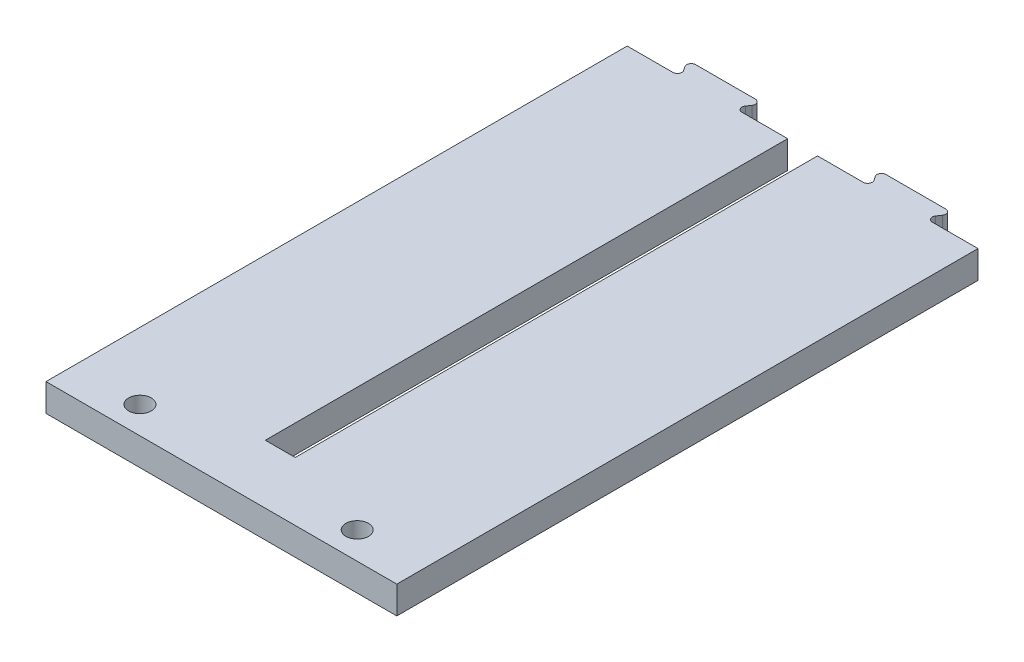
from build123d import *

# Parameters (mm, degrees)
SKETCH1_W                   = 38.75
SKETCH1_H                   = 72.5
BOSS_EXTRUDE1_DEPTH         = 3.05
SKETCH4_W                   = 1.65
SKETCH4_H                   = 1
SKETCH4_H_2                 = 61.8
CUT_EXTRUDE1_DEPTH          = 76.106212293
SKETCH8_W                   = 38.75
SKETCH8_H                   = 8.3
CUT_EXTRUDE5_DEPTH          = 76.106212293
BOSS_EXTRUDE3_DEPTH         = 3.05
FILLET2_R                   = 0.5
TAP_DRILL_FOR_M3X0_5_TAP1_D = 2.5


with BuildPart() as part:
    # Sketch1 → Boss-Extrude1 (new body)
    with BuildSketch(Plane(origin=(0, 0, 0), x_dir=(1, 0, 0), z_dir=(0, 1, 0))):
        with Locations((0, 36.25)):
            Rectangle(SKETCH1_W, SKETCH1_H)
    extrude(amount=BOSS_EXTRUDE1_DEPTH)

    # Sketch4 → Cut-Extrude1 (cut, through all)
    with BuildSketch(Plane(origin=(0, 3.05, 0), x_dir=(1, 0, 0), z_dir=(0, 1, 0))):
        with Locations((-0.825, 70)):
            Rectangle(SKETCH4_W, SKETCH4_H)
        with Locations((-0.825, 37.4)):
            Rectangle(SKETCH4_W, SKETCH4_H_2)
        with Locations((0.825, 37.4)):
            Rectangle(SKETCH4_W, SKETCH4_H_2)
        with Locations((0.825, 70)):
            Rectangle(SKETCH4_W, SKETCH4_H)
    extrude(amount=-CUT_EXTRUDE1_DEPTH, mode=Mode.SUBTRACT)

    # Sketch8 → Cut-Extrude5 (cut, through all)
    with BuildSketch(Plane(origin=(0, 3.05, 0), x_dir=(1, 0, 0), z_dir=(0, 1, 0))):
        with Locations((0, 68.35)):
            Rectangle(SKETCH8_W, SKETCH8_H)
    extrude(amount=-CUT_EXTRUDE5_DEPTH, mode=Mode.SUBTRACT)

    # Sketch9 → Boss-Extrude3 (add)
    with BuildSketch(Plane(origin=(0, 3.05, 0), x_dir=(1, 0, 0), z_dir=(0, 1, 0))):
        Polygon((-14.7625, 66.2), (-13.375, 64.2), (-7.65, 64.2), (-6.2625, 66.2), align=None)
        Polygon((6.2625, 66.2), (7.65, 64.2), (13.375, 64.2), (14.7625, 66.2), align=None)
    extrude(amount=-BOSS_EXTRUDE3_DEPTH)

    # Fillet2
    fillet2_edges = [part.edges().sort_by_distance(p)[0] for p in [
        (14.7625, 1.525, -66.2),
        (13.375, 1.525, -64.2),
        (7.65, 1.525, -64.2),
        (6.2625, 1.525, -66.2),
        (-6.2625, 1.525, -66.2),
        (-7.65, 1.525, -64.2),
        (-13.375, 1.525, -64.2),
        (-14.7625, 1.525, -66.2),
    ]]
    fillet(fillet2_edges, radius=FILLET2_R)

    # Tap Drill for M3x0.5 Tap1 (through all)
    with Locations(Plane(origin=(0, 3.05, 0), x_dir=(1, 0, 0), z_dir=(0, 1, 0))):
        with Locations((-12, 3), (12, 3)):
            Hole(TAP_DRILL_FOR_M3X0_5_TAP1_D / 2)


solid = part.part
